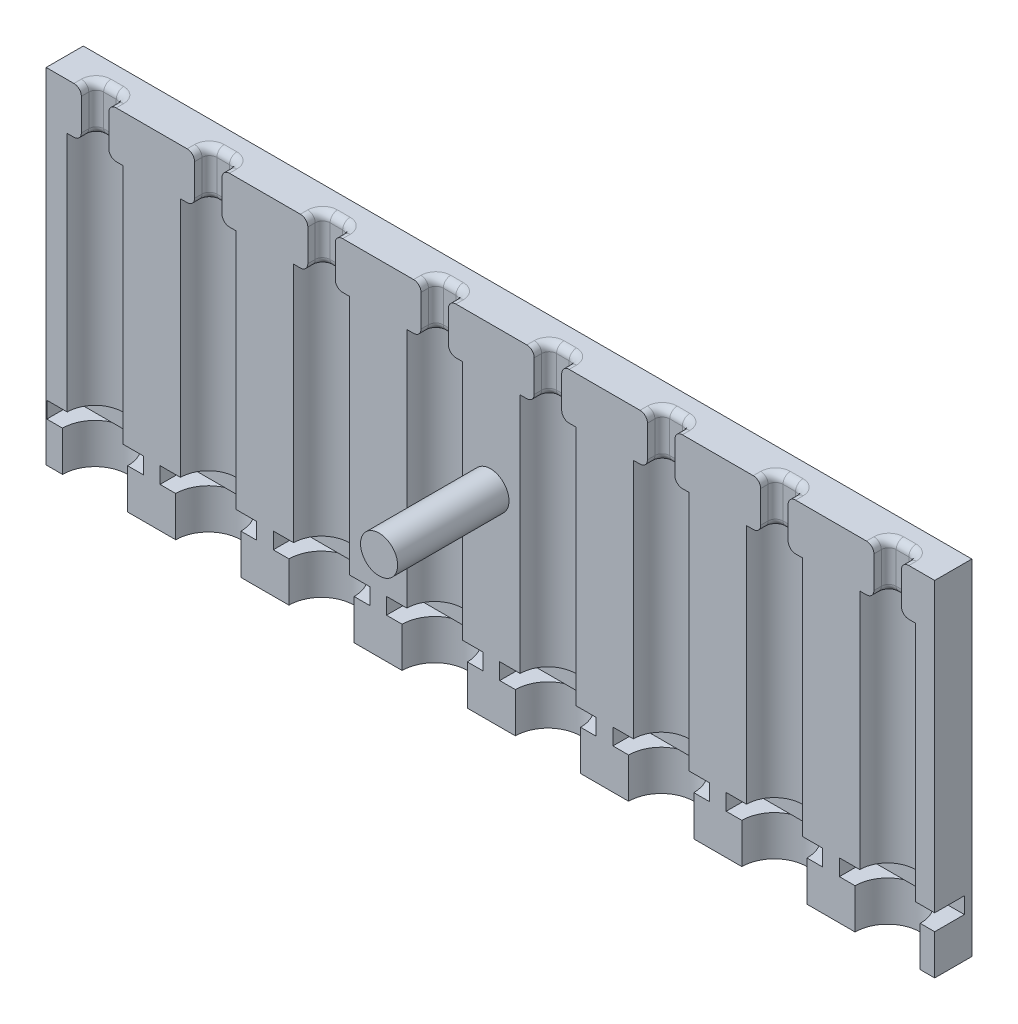
from build123d import *

# Parameters (mm, degrees)
SKETCH1_W              = 150
SKETCH1_H              = 300
BOSS_EXTRUDE1_DEPTH    = 10
FLANGE_SLIT_W          = 26
FLANGE_SLIT_H          = 4.4
FLANGE_SLOT_DEPTH      = 8
SKETCH3_W              = 7.5
SKETCH3_H              = 65
SKETCH6_W              = 57.250839866
SKETCH6_H              = 300
CUT_EXTRUDE2_DEPTH     = 169.002976164
SKETCH7_W              = 8.778199967
SKETCH7_H              = 10.8
SKETCH8_W              = 7.4
SKETCH8_H              = 25.098320268
NEEDLE_SLOT_DEPTH      = 4
FILLET1_R              = 2
LPATTERN3_COUNT        = 10
LPATTERN3_PITCH        = 30.5
FILLET1_OF_LPATTERN3_R = 2
SKETCH9_R              = 5
BOSS_EXTRUDE3_DEPTH    = 30
SKETCH10_W             = 30.32381617
SKETCH10_H             = 92.749160134
CUT_EXTRUDE3_DEPTH     = 171.367250374


with BuildPart() as part:
    # Sketch1 → Boss-Extrude1 (new body)
    with BuildSketch(Plane(origin=(0, 0, 0), x_dir=(0, 1, 0), z_dir=(0, 0, 1))):
        Rectangle(SKETCH1_W, SKETCH1_H)
    extrude(amount=BOSS_EXTRUDE1_DEPTH)

    # flange slit → Flange Slot (cut)
    with BuildSketch(Plane.XY.offset(10)):
        with Locations((-137, -62)):
            Rectangle(FLANGE_SLIT_W, FLANGE_SLIT_H)
    flange_slot = extrude(amount=-FLANGE_SLOT_DEPTH, mode=Mode.SUBTRACT)

    # Sketch3 → Syringe Body Slot (revolve, cut)
    with BuildSketch(Plane.XY.offset(10)):
        with Locations((-140.75, -27.3)):
            Rectangle(SKETCH3_W, SKETCH3_H)
    syringe_body_slot = revolve(axis=Axis((-137, 75, 10), (0, -1, 0)), mode=Mode.SUBTRACT)

    # Sketch6 → Cut-Extrude2 (cut, through all)
    with BuildSketch(Plane(origin=(0, 0, 10), x_dir=(0, -1, 0), z_dir=(0, 0, 1))):
        with Locations((-46.374580067, 0)):
            Rectangle(SKETCH6_W, SKETCH6_H)
    extrude(amount=-CUT_EXTRUDE2_DEPTH, mode=Mode.SUBTRACT)

    # Sketch7 → Plunger Slot (revolve, cut)
    with BuildSketch(Plane.XY.offset(10)):
        with Locations((-141.389099983, -69.6)):
            Rectangle(SKETCH7_W, SKETCH7_H)
    plunger_slot = revolve(axis=Axis((-137, -64.2, 10), (0, -1, 0)), mode=Mode.SUBTRACT)

    # Sketch8 → Needle Slot (cut)
    with BuildSketch(Plane.XY.offset(10)):
        with Locations((-137, 5.2)):
            Rectangle(SKETCH8_W, SKETCH8_H)
    needle_slot = extrude(amount=-NEEDLE_SLOT_DEPTH, mode=Mode.SUBTRACT)

    # Fillet1
    fillet1_edges = [part.edges().sort_by_distance(p)[0] for p in [
        (-140.7, 5.2, 8),
        (-133.3, 5.2, 8),
        (-137, 5.2, 6),
        (-133.3, 11.474580067, 6),
        (-133.3, 17.749160134, 8),
        (-140.7, 11.474580067, 6),
        (-137, 17.749160134, 6),
        (-140.7, 17.749160134, 8),
    ]]
    fillet(fillet1_edges, radius=FILLET1_R)

    # LPattern3: Flange Slot, Syringe Body Slot, Plunger Slot, Needle Slot ×10
    with Locations(*[(i * LPATTERN3_PITCH, 0, 0) for i in range(1, LPATTERN3_COUNT)]):
        add(flange_slot, mode=Mode.SUBTRACT)
        add(syringe_body_slot, mode=Mode.SUBTRACT)
        add(plunger_slot, mode=Mode.SUBTRACT)
        add(needle_slot, mode=Mode.SUBTRACT)

    # Fillet1 of LPattern3
    fillet1_of_lpattern3_edges = [part.edges().sort_by_distance(p)[0] for p in [
        (-110.2, 5.2, 8),
        (-102.8, 5.2, 8),
        (-106.5, 5.2, 6),
        (-102.8, 11.474580067, 6),
        (-102.8, 17.749160134, 8),
        (-110.2, 11.474580067, 6),
        (-106.5, 17.749160134, 6),
        (-110.2, 17.749160134, 8),
        (-79.7, 5.2, 8),
        (-72.3, 5.2, 8),
        (-76, 5.2, 6),
        (-72.3, 11.474580067, 6),
        (-72.3, 17.749160134, 8),
        (-79.7, 11.474580067, 6),
        (-76, 17.749160134, 6),
        (-79.7, 17.749160134, 8),
        (-49.2, 5.2, 8),
        (-41.8, 5.2, 8),
        (-45.5, 5.2, 6),
        (-41.8, 11.474580067, 6),
        (-41.8, 17.749160134, 8),
        (-49.2, 11.474580067, 6),
        (-45.5, 17.749160134, 6),
        (-49.2, 17.749160134, 8),
        (-18.7, 5.2, 8),
        (-11.3, 5.2, 8),
        (-15, 5.2, 6),
        (-11.3, 11.474580067, 6),
        (-11.3, 17.749160134, 8),
        (-18.7, 11.474580067, 6),
        (-15, 17.749160134, 6),
        (-18.7, 17.749160134, 8),
        (11.8, 5.2, 8),
        (19.2, 5.2, 8),
        (15.5, 5.2, 6),
        (19.2, 11.474580067, 6),
        (19.2, 17.749160134, 8),
        (11.8, 11.474580067, 6),
        (15.5, 17.749160134, 6),
        (11.8, 17.749160134, 8),
        (42.3, 5.2, 8),
        (49.7, 5.2, 8),
        (46, 5.2, 6),
        (49.7, 11.474580067, 6),
        (49.7, 17.749160134, 8),
        (42.3, 11.474580067, 6),
        (46, 17.749160134, 6),
        (42.3, 17.749160134, 8),
        (72.8, 5.2, 8),
        (80.2, 5.2, 8),
        (76.5, 5.2, 6),
        (80.2, 11.474580067, 6),
        (80.2, 17.749160134, 8),
        (72.8, 11.474580067, 6),
        (76.5, 17.749160134, 6),
        (72.8, 17.749160134, 8),
        (103.3, 5.2, 8),
        (110.7, 5.2, 8),
        (107, 5.2, 6),
        (110.7, 11.474580067, 6),
        (110.7, 17.749160134, 8),
        (103.3, 11.474580067, 6),
        (107, 17.749160134, 6),
        (103.3, 17.749160134, 8),
        (133.8, 5.2, 8),
        (141.2, 5.2, 8),
        (137.5, 5.2, 6),
        (141.2, 11.474580067, 6),
        (141.2, 17.749160134, 8),
        (133.8, 11.474580067, 6),
        (137.5, 17.749160134, 6),
        (133.8, 17.749160134, 8),
    ]]
    fillet(fillet1_of_lpattern3_edges, radius=FILLET1_OF_LPATTERN3_R)

    # Sketch9 → Boss-Extrude3 (add)
    with BuildSketch(Plane.XY.offset(10)):
        with Locations(Location((0, -21.025419933, 0), (0, 0, 180))):
            Circle(SKETCH9_R)
    extrude(amount=BOSS_EXTRUDE3_DEPTH)

    # Sketch10 → Cut-Extrude3 (cut, through all)
    with BuildSketch(Plane.XY.offset(10)):
        with Locations((-134.838091915, -28.625419933)):
            Rectangle(SKETCH10_W, SKETCH10_H)
    cut_extrude3 = extrude(amount=-CUT_EXTRUDE3_DEPTH, mode=Mode.SUBTRACT)

    # Mirror1: Cut-Extrude3 across plane
    add(cut_extrude3.mirror(Plane(origin=(0, 0, 0), x_dir=(0, 0, 1), z_dir=(1, 0, 0))), mode=Mode.SUBTRACT)


solid = part.part
